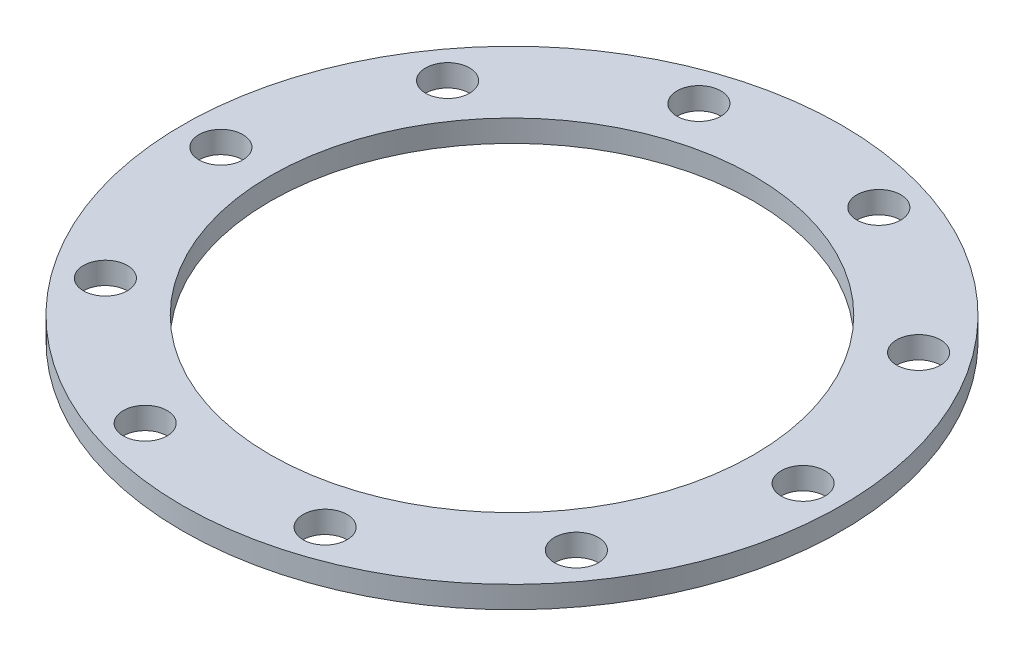
from build123d import *

# Parameters (mm, degrees)
SKETCH1_R           = 76.2
SKETCH1_R_2         = 55.88
BOSS_EXTRUDE1_DEPTH = 5.08
SKETCH2_R           = 5.08
CUT_EXTRUDE1_DEPTH  = 108.882743755
CIRPATTERN1_COUNT   = 10


with BuildPart() as part:
    # Sketch1 → Boss-Extrude1 (new body)
    with BuildSketch(Plane(origin=(0, 0, 0), x_dir=(1, 0, 0), z_dir=(0, 1, 0))):
        with Locations(Location((0, 0, 0), (0, 0, 270))):
            Circle(SKETCH1_R)
        with Locations(Location((0, 0, 0), (0, 0, 270))):
            Circle(SKETCH1_R_2, mode=Mode.SUBTRACT)
    extrude(amount=BOSS_EXTRUDE1_DEPTH)

    # Sketch2 → Cut-Extrude1 (cut, through all)
    with BuildSketch(Plane(origin=(0, 5.08, 0), x_dir=(1, 0, 0), z_dir=(0, 1, 0))):
        with Locations(Location((-67.31, 0, 0), (0, 0, 270))):
            Circle(SKETCH2_R)
    cut_extrude1 = extrude(amount=-CUT_EXTRUDE1_DEPTH, mode=Mode.SUBTRACT)

    # CirPattern1: Cut-Extrude1 ×10 about axis
    cirpattern1_axis = Axis((0, 0, 0), (0, 1, 0))
    for i in range(1, CIRPATTERN1_COUNT):
        add(cut_extrude1.rotate(cirpattern1_axis, i * 360 / CIRPATTERN1_COUNT), mode=Mode.SUBTRACT)


solid = part.part
